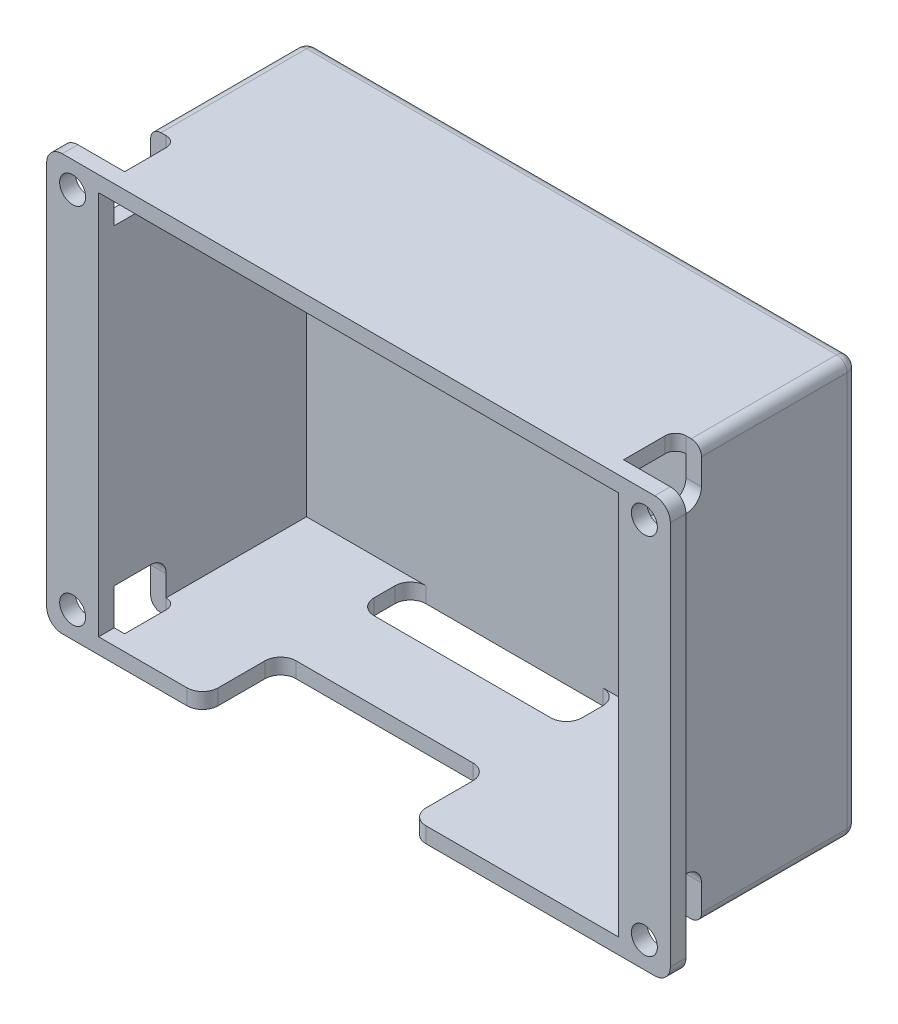
from build123d import *

# Parameters (mm, degrees)
SKETCH2_R           = 1.2500000000000047
SKETCH2_R_2         = 1.2499999999999978
BOSS_EXTRUDE3_DEPTH = 1.5
BOSS_EXTRUDE4_DEPTH = 20
CUT_EXTRUDE4_DEPTH  = 20
CUT_EXTRUDE8_DEPTH  = 2.5
SKETCH12_W          = 5.000000000000005
SKETCH12_H          = 4.999999999999993
CUT_EXTRUDE9_DEPTH  = 2.5
CUT_EXTRUDE11_DEPTH = 5
FILLET6_R           = 1.5
FILLET7_R           = 1


with BuildPart() as part:
    # Sketch2 → Boss-Extrude3 (new body)
    with BuildSketch(Plane.XY):
        Polygon((15.305986754735851, 62.83362130987144), (75.30598675473586, 62.83362130987144), (75.30598675473586, 22.83362130987144), (15.305986754735857, 22.83362130987144), align=None)
        with Locations((17.80598675473585, 60.33362130987144)):
            Circle(SKETCH2_R, mode=Mode.SUBTRACT)
        with Locations((17.80598675473585, 25.333621309871436)):
            Circle(SKETCH2_R_2, mode=Mode.SUBTRACT)
        with Locations((72.80598675473584, 25.33362130987144)):
            Circle(SKETCH2_R_2, mode=Mode.SUBTRACT)
        with Locations((72.80598675473584, 60.33362130987144)):
            Circle(SKETCH2_R_2, mode=Mode.SUBTRACT)
    extrude(amount=BOSS_EXTRUDE3_DEPTH)

    # Sketch3 → Boss-Extrude4 (add)
    with BuildSketch(Plane(origin=(0, 0, 0), x_dir=(-1, 0, 0), z_dir=(0, 0, -1))):
        Polygon((-71.80598675473584, 62.83362130987144), (-18.805986754735855, 62.83362130987144), (-18.805986754735848, 22.83362130987144), (-71.80598675473584, 22.83362130987144), align=None)
    extrude(amount=BOSS_EXTRUDE4_DEPTH)

    # Sketch7 → Cut-Extrude4 (cut)
    with BuildSketch(Plane.XY.offset(1.5)):
        Polygon((20.30598675473585, 61.33362130987144), (70.30598675473584, 61.33362130987144), (70.30598675473584, 24.33362130987144), (20.305986754735855, 24.33362130987144), align=None)
    extrude(amount=-CUT_EXTRUDE4_DEPTH, mode=Mode.SUBTRACT)

    # Sketch11 → Cut-Extrude8 (cut)
    with BuildSketch(Plane.ZY.offset(-18.805986754735844)):
        Polygon((0, 62.83362130987144), (-5, 62.83362130987144), (-4.999999999999999, 57.83362130987144), (6.1e-16, 57.83362130987144), align=None)
        Polygon((0, 22.833621309871443), (-4.999999999999999, 22.833621309871443), (-4.999999999999996, 27.83362130987144), (0, 27.83362130987144), align=None)
    extrude(amount=-CUT_EXTRUDE8_DEPTH, mode=Mode.SUBTRACT)

    # Sketch12 → Cut-Extrude9 (cut)
    with BuildSketch(Plane(origin=(71.80598675473584, 0, 0), x_dir=(0, 0, -1), z_dir=(1, 0, 0))):
        Polygon((0, 62.83362130987144), (5, 62.83362130987144), (5.000000000000001, 57.83362130987144), (6.1e-16, 57.83362130987144), align=None)
        with Locations((2.5000000000000027, 25.333621309871436)):
            Rectangle(SKETCH12_W, SKETCH12_H)
    extrude(amount=-CUT_EXTRUDE9_DEPTH, mode=Mode.SUBTRACT)

    # Sketch15 → Cut-Extrude11 (cut)
    with BuildSketch(Plane.XZ.offset(-22.83362130987144)):
        Polygon((50.30598675473586, 1.5), (30.30598675473586, 1.4999999999999971), (30.30598675473586, -6.000000000000003), (50.30598675473586, -6), align=None)
        Polygon((50.30598675473587, -18.5), (30.305986754735855, -18.500000000000004), (30.30598675473586, -13.500000000000002), (50.30598675473587, -13.499999999999998), align=None)
    extrude(amount=-CUT_EXTRUDE11_DEPTH, mode=Mode.SUBTRACT)

    # Fillet6
    fillet6_edges = [part.edges().sort_by_distance(p)[0] for p in [
        (71.05598675473584, 57.83362130987144, -5.000000000000001),
        (71.05598675473584, 27.833621309871436, -5.000000000000005),
        (50.30598675473586, 23.58362130987144, 1.5),
        (50.30598675473586, 23.58362130987144, -6),
        (30.30598675473586, 23.58362130987144, -6.000000000000003),
        (30.30598675473586, 23.58362130987144, 1.4999999999999971),
        (50.30598675473587, 23.58362130987144, -18.5),
        (30.30598675473586, 23.58362130987144, -13.500000000000002),
        (50.30598675473587, 23.58362130987144, -13.499999999999998),
        (30.305986754735855, 23.58362130987144, -18.500000000000004),
        (15.305986754735851, 62.83362130987144, 0.75),
        (75.30598675473586, 62.83362130987144, 0.75),
        (75.30598675473586, 22.83362130987144, 0.75),
        (19.555986754735855, 57.83362130987144, -4.999999999999999),
        (15.305986754735857, 22.83362130987144, 0.75),
        (19.555986754735855, 27.833621309871436, -4.999999999999996),
    ]]
    fillet(fillet6_edges, radius=FILLET6_R)

    # Fillet7
    fillet7_edges = [part.edges().sort_by_distance(p)[0] for p in [
        (45.30598675473585, 62.83362130987144, -20),
        (18.80598675473585, 42.83362130987144, -20),
        (45.30598675473584, 22.83362130987144, -20),
        (71.80598675473584, 42.83362130987144, -20),
        (21.305986754735848, 23.58362130987144, -4.999999999999998),
        (69.30598675473584, 23.58362130987144, -5.000000000000005),
        (69.30598675473584, 62.08362130987144, -5),
        (21.305986754735855, 62.08362130987144, -5),
        (71.80598675473584, 62.83362130987144, -12.5),
        (18.805986754735855, 62.83362130987144, -12.5),
        (71.80598675473584, 22.83362130987144, -12.500000000000004),
        (18.805986754735848, 22.83362130987144, -12.5),
    ]]
    fillet(fillet7_edges, radius=FILLET7_R)


solid = part.part
